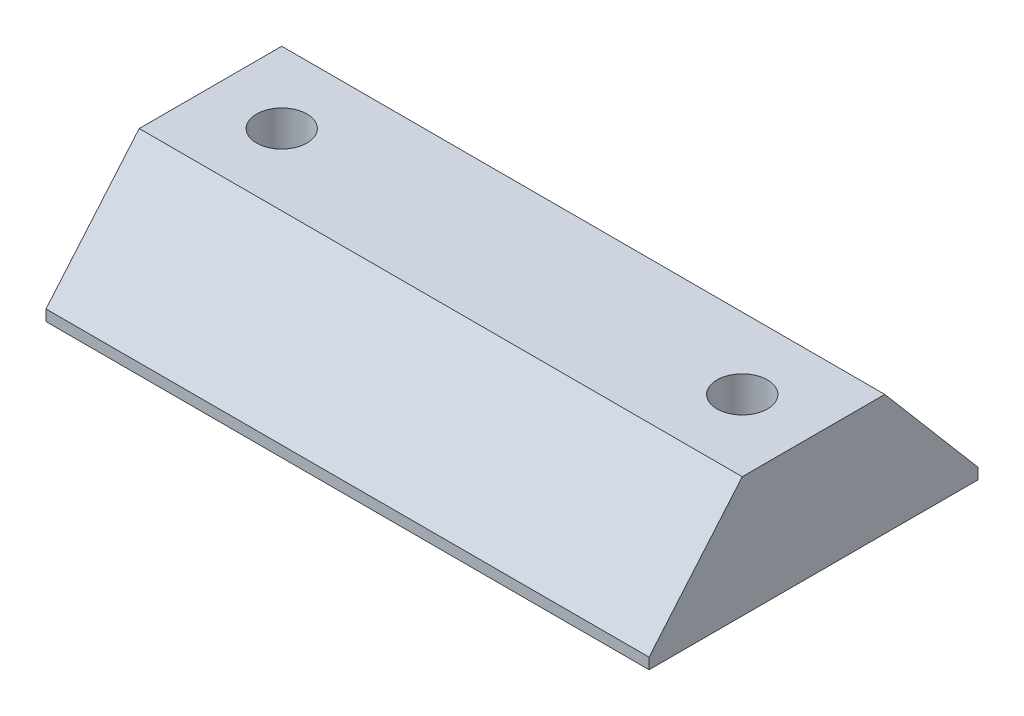
from build123d import *
from OCP.BRepFilletAPI import BRepFilletAPI_MakeChamfer

# Parameters (mm, degrees)
SKETCH2_W           = 55
SKETCH2_H           = 30
BOSS_EXTRUDE1_DEPTH = 11
CHAMFER1_SIZE       = 10
CHAMFER1_SIZE2      = 8.5
CUT_EXTRUDE1_REACH  = 65.608
SKETCH3_R           = 2.3
SKETCH4_W           = 22
SKETCH4_H           = 7.8
BOSS_EXTRUDE2_DEPTH = 3


with BuildPart() as part:
    # Sketch2 → Boss-Extrude1 (new body)
    with BuildSketch(Plane(origin=(0, 0, 0), x_dir=(1, 0, 0), z_dir=(0, 1, 0))):
        with Locations((27.5, 15)):
            Rectangle(SKETCH2_W, SKETCH2_H)
    extrude(amount=BOSS_EXTRUDE1_DEPTH)

    # Chamfer1: one chamfer whose edges measure the first distance from different faces: ONE call of the kernel's chamfer builder (chamfer() names one face for all edges)
    chamfer1_edges_1 = [part.edges().sort_by_distance(p)[0] for p in [
        (27.5, 11, -30),
    ]]
    chamfer1_side_1 = [part.faces().sort_by_distance(p)[0] for p in [
        (27.5, 5.5, -30),
    ]]
    chamfer1_edges_2 = [part.edges().sort_by_distance(p)[0] for p in [
        (27.5, 11, 0),
    ]]
    chamfer1_side_2 = [part.faces().sort_by_distance(p)[0] for p in [
        (27.5, 5.5, 0),
    ]]
    chamfer1 = BRepFilletAPI_MakeChamfer(part.part.solid().wrapped)
    for e in chamfer1_edges_1:
        chamfer1.Add(CHAMFER1_SIZE, CHAMFER1_SIZE2, e.wrapped, chamfer1_side_1[0].wrapped)  # the first distance lies on this face
    for e in chamfer1_edges_2:
        chamfer1.Add(CHAMFER1_SIZE, CHAMFER1_SIZE2, e.wrapped, chamfer1_side_2[0].wrapped)  # the first distance lies on this face
    add(Compound.cast(chamfer1.Shape()), mode=Mode.REPLACE)

    # Sketch3 → Cut-Extrude1 (cut, up to next)
    with BuildSketch(Plane(origin=(0, 11, 0), x_dir=(1, 0, 0), z_dir=(0, 1, 0)), mode=Mode.PRIVATE) as cut_extrude1_sk1:
        with Locations(Location((6.5, 15, 0), (0, 0, 270))):
            Circle(SKETCH3_R)
    cut_extrude1_tool1 = extrude(cut_extrude1_sk1.sketch, amount=-CUT_EXTRUDE1_REACH, mode=Mode.PRIVATE) & part.part
    # Sketch3 → Cut-Extrude1 (cut, up to next)
    with BuildSketch(Plane(origin=(0, 11, 0), x_dir=(1, 0, 0), z_dir=(0, 1, 0)), mode=Mode.PRIVATE) as cut_extrude1_sk2:
        with Locations(Location((48.5, 15, 0), (0, 0, 270))):
            Circle(SKETCH3_R)
    cut_extrude1_tool2 = extrude(cut_extrude1_sk2.sketch, amount=-CUT_EXTRUDE1_REACH, mode=Mode.PRIVATE) & part.part
    add(cut_extrude1_tool1.solids().sort_by_distance((6.5, 11, -15))[0], mode=Mode.SUBTRACT)
    add(cut_extrude1_tool2.solids().sort_by_distance((48.5, 11, -15))[0], mode=Mode.SUBTRACT)

    # Sketch4 → Boss-Extrude2 (add)
    with BuildSketch(Plane.XZ):
        with Locations((27.5, -14.15)):
            Rectangle(SKETCH4_W, SKETCH4_H)
    extrude(amount=BOSS_EXTRUDE2_DEPTH)


solid = part.part
